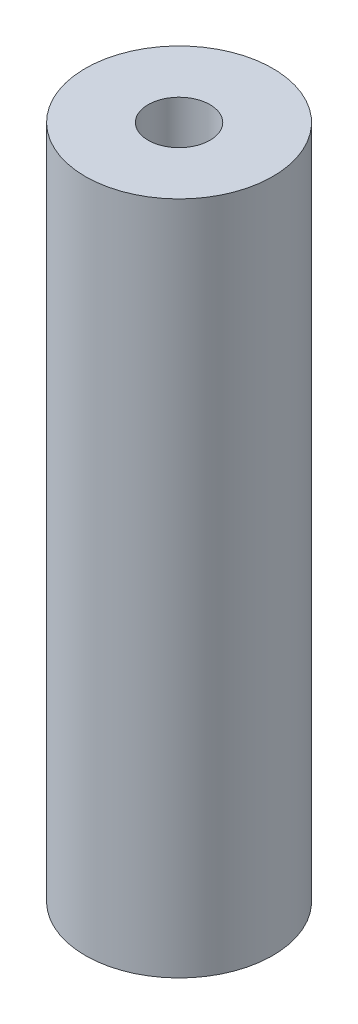
from build123d import *

# Parameters (mm, degrees)
SKETCH_1_R      = 5
SKETCH_1_R_2    = 1.65
EXTRUDE_1_DEPTH = 36


with BuildPart() as part:
    # Эскиз1 → Бобышка-Вытянуть1 (new body)
    with BuildSketch(Plane(origin=(0, 0, 0), x_dir=(1, 0, 0), z_dir=(0, 1, 0))):
        with Locations(Location((0, 0, 0), (0, 0, 270))):
            Circle(SKETCH_1_R)
        with Locations(Location((0, 0, 0), (0, 0, 270))):
            Circle(SKETCH_1_R_2, mode=Mode.SUBTRACT)
    extrude(amount=EXTRUDE_1_DEPTH)


solid = part.part
